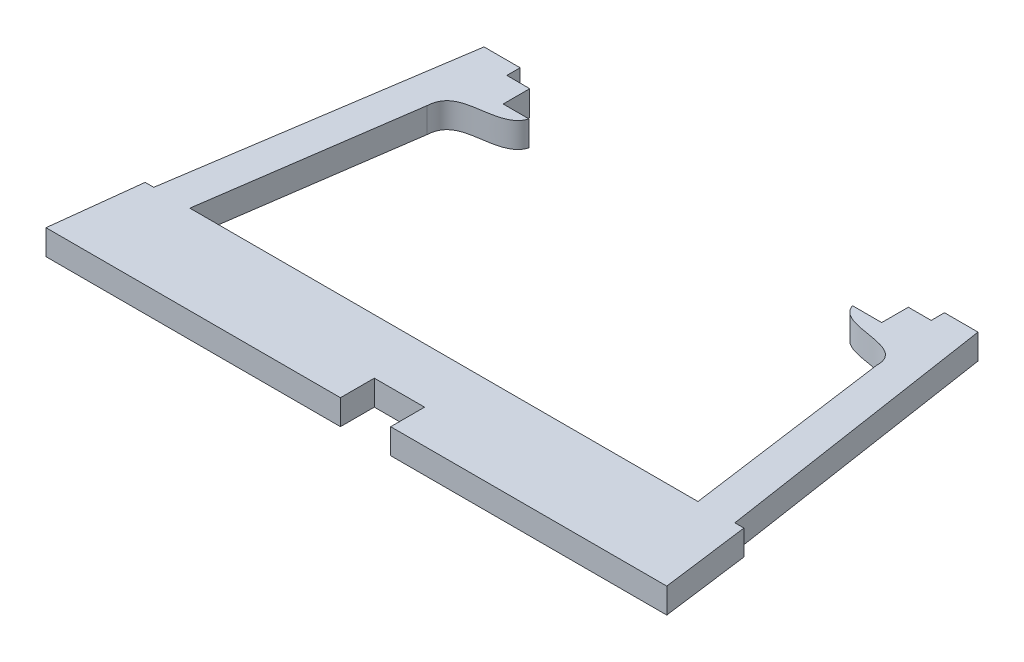
from build123d import *

# Parameters (mm, degrees)
EXTRUDE_1_DEPTH = 4


with BuildPart() as part:
    # 草图1 → 凸台-拉伸1 (new body)
    with BuildSketch(Plane(origin=(0, 0, 0), x_dir=(1, 0, 0), z_dir=(0, 1, 0))):
        with BuildLine():
            Line((-49.404028848, -126.014907086), (-51.26736259, -111.870510049))
            Line((-51.26736259, -111.870510049), (-52.70721139, -111.870510049))
            Line((-52.70721139, -111.870510049), (-59.652364426, -66.218833388))
            Line((-59.652364426, -66.218833388), (-64.988274685, -66.218833388))
            Line((-64.988274685, -66.218833388), (-64.988274685, -68.336258094))
            Line((-64.988274685, -68.336258094), (-68.630245179, -68.336258094))
            Line((-68.630245179, -68.336258094), (-68.630245179, -72.571107506))
            Line((-68.630245179, -72.571107506), (-73.288579532, -72.571107506))
            add(Edge.make_bspline(
                [(-63.143369767, -78.862797811), (-62.992435868, -73.662892561), (-71.907525745, -76.703218171), (-73.288579532, -72.571107506)],
                knots=[0, 0, 0, 0, 1, 1, 1, 1], degree=3))
            Line((-63.143369767, -78.862797811), (-58.583386552, -111.870510049))
            Line((-58.583386552, -111.870510049), (-139.477488779, -111.870510049))
            Line((-139.477488779, -111.870510049), (-134.735106236, -78.862797811))
            add(Edge.make_bspline(
                [(-124.794342828, -72.571107506), (-125.277958037, -74.232765948), (-129.876755781, -75.477760941), (-134.529259996, -75.567175036), (-134.735106236, -78.862797811)],
                knots=[0, 0, 0, 0, 0.392720746, 1, 1, 1, 1], degree=3))
            Line((-124.794342828, -72.571107506), (-128.898327721, -72.571107506))
            Line((-128.898327721, -72.571107506), (-128.898327721, -68.336258094))
            Line((-128.898327721, -68.336258094), (-132.546314293, -68.336258094))
            Line((-132.546314293, -68.336258094), (-132.546314293, -66.218833388))
            Line((-132.546314293, -66.218833388), (-138.291893143, -66.218833388))
            Line((-138.291893143, -66.218833388), (-145.223067629, -111.870510049))
            Line((-145.223067629, -111.870510049), (-146.591062594, -111.870510049))
            Line((-146.591062594, -111.870510049), (-148.232656551, -126.014907086))
            Line((-148.232656551, -126.014907086), (-101.356029105, -126.014907086))
            Line((-101.356029105, -126.014907086), (-101.356029105, -120.624924421))
            Line((-101.356029105, -120.624924421), (-93.356029105, -120.624924421))
            Line((-93.356029105, -120.624924421), (-93.356029105, -126.014907086))
            Line((-93.356029105, -126.014907086), (-49.404028848, -126.014907086))
        make_face()
    extrude(amount=EXTRUDE_1_DEPTH)


solid = part.part
